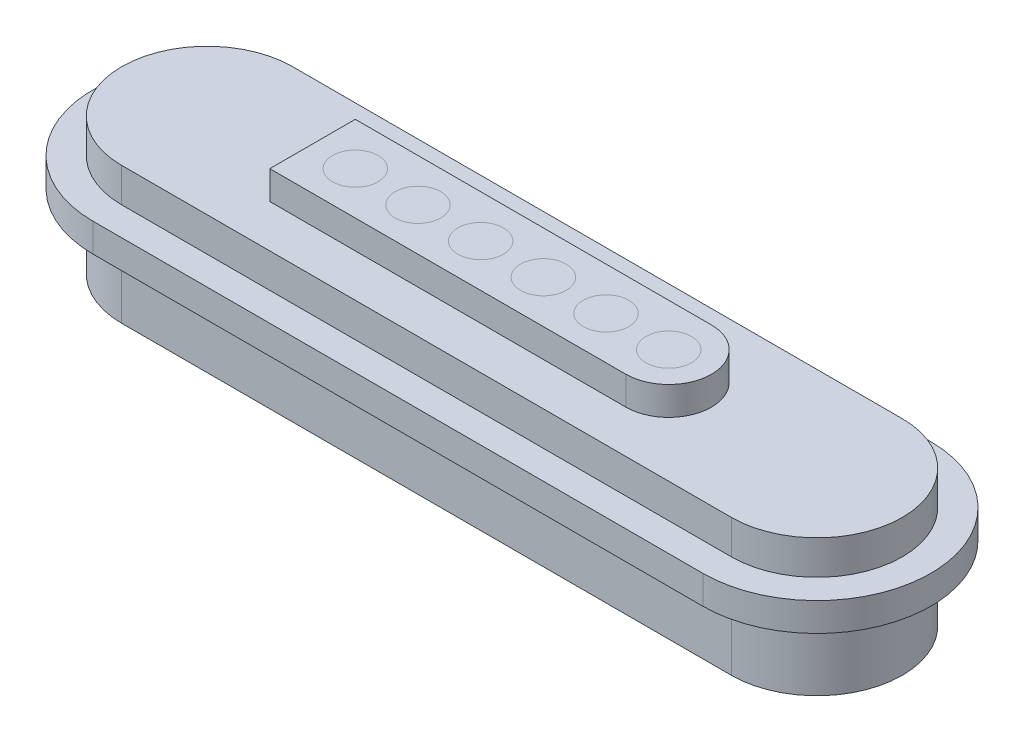
from build123d import *

# Parameters (mm, degrees)
BOSS_EXTRUDE1_DEPTH        = 4.8
SKETCH1_3_R                = 0.8
BOSS_EXTRUDE2_DEPTH        = 5.8
BOSS_EXTRUDE3_START        = 2.6
BOSS_EXTRUDE3_DEPTH        = 1
BOSS_EXTRUDE4_DEPTH        = 5.8
BOSS_EXTRUDE4_DEPTH_BACK   = 1.5
SKETCH1_5_R                = 0.8
BOSS_EXTRUDE4_2_DEPTH      = 5.8
BOSS_EXTRUDE4_2_DEPTH_BACK = 1.5
BOSS_EXTRUDE4_3_DEPTH      = 5.8
BOSS_EXTRUDE4_3_DEPTH_BACK = 1.5
BOSS_EXTRUDE4_4_DEPTH      = 5.8
BOSS_EXTRUDE4_4_DEPTH_BACK = 1.5
BOSS_EXTRUDE4_5_DEPTH      = 5.8
BOSS_EXTRUDE4_5_DEPTH_BACK = 1.5
BOSS_EXTRUDE4_6_DEPTH      = 5.8
BOSS_EXTRUDE4_6_DEPTH_BACK = 1.5


with BuildPart() as part:
    # Sketch1 → Boss-Extrude1 (new body)
    with BuildSketch(Plane(origin=(0, 0, 0), x_dir=(1, 0, 0), z_dir=(0, 1, 0))):
        with BuildLine():
            Line((21.4, 3), (0, 3))
            ThreePointArc((0, 3), (-3, 0), (0, -3))
            Line((0, -3), (21.4, -3))
            ThreePointArc((21.4, -3), (24.4, 0), (21.4, 3))
        make_face()
        with BuildLine():
            ThreePointArc((16.213938129, 1.499935241), (17.699983809, -0.006969321), (16.199999637, -1.5))
            Line((16.199999637, -1.5), (3.699983809, -1.499996975))
            Line((3.699983809, -1.499996975), (3.699983809, 1.499935241))
            Line((3.699983809, 1.499935241), (16.213938129, 1.499935241))
        make_face(mode=Mode.SUBTRACT)
    extrude(amount=BOSS_EXTRUDE1_DEPTH)

    # Sketch1<3> → Boss-Extrude2 (add)
    with BuildSketch(Plane(origin=(0, 0, 0), x_dir=(1, 0, 0), z_dir=(0, 1, 0))):
        with BuildLine():
            Line((3.699983809, -1.499996975), (16.199999637, -1.5))
            ThreePointArc((16.199999637, -1.5), (17.699983809, -0.006969321), (16.213938129, 1.499935241))
            Line((16.213938129, 1.499935241), (3.699983809, 1.499935241))
            Line((3.699983809, 1.499935241), (3.699983809, -1.499996975))
        make_face()
        with Locations((5.2, 0)):
            Circle(SKETCH1_3_R, mode=Mode.SUBTRACT)
        with Locations((7.4, 0)):
            Circle(SKETCH1_3_R, mode=Mode.SUBTRACT)
        with Locations((9.6, 0)):
            Circle(SKETCH1_3_R, mode=Mode.SUBTRACT)
        with Locations((11.8, 0)):
            Circle(SKETCH1_3_R, mode=Mode.SUBTRACT)
        with Locations((14, 0)):
            Circle(SKETCH1_3_R, mode=Mode.SUBTRACT)
        with Locations((16.2, 0)):
            Circle(SKETCH1_3_R, mode=Mode.SUBTRACT)
    extrude(amount=BOSS_EXTRUDE2_DEPTH)

    # Sketch1<4> → Boss-Extrude3 (add)
    with BuildSketch(Plane(origin=(0, 0, 0), x_dir=(1, 0, 0), z_dir=(0, 1, 0)).offset(BOSS_EXTRUDE3_START)):
        with BuildLine():
            Line((21.4, 4), (0, 4))
            ThreePointArc((0, 4), (-4, 0), (0, -4))
            Line((0, -4), (21.4, -4))
            ThreePointArc((21.4, -4), (25.4, 0), (21.4, 4))
        make_face()
        with BuildLine():
            ThreePointArc((0, -3), (-3, 0), (0, 3))
            Line((0, 3), (21.4, 3))
            ThreePointArc((21.4, 3), (24.4, 0), (21.4, -3))
            Line((21.4, -3), (0, -3))
        make_face(mode=Mode.SUBTRACT)
    extrude(amount=BOSS_EXTRUDE3_DEPTH)


with BuildPart() as body_2:
    # Sketch1<5> → Boss-Extrude4 (new, two sides: drawn at the far end of the back side and taken through both)
    with BuildSketch(Plane(origin=(0, 0, 0), x_dir=(1, 0, 0), z_dir=(0, 1, 0)).offset(-BOSS_EXTRUDE4_DEPTH_BACK)):
        with Locations((11.8, 0)):
            Circle(SKETCH1_5_R)
    extrude(amount=BOSS_EXTRUDE4_DEPTH + BOSS_EXTRUDE4_DEPTH_BACK)


with BuildPart() as body_3:
    # Sketch1<5> → Boss-Extrude4 2 (new, two sides: drawn at the far end of the back side and taken through both)
    with BuildSketch(Plane(origin=(0, 0, 0), x_dir=(1, 0, 0), z_dir=(0, 1, 0)).offset(-BOSS_EXTRUDE4_2_DEPTH_BACK)):
        with Locations((14, 0)):
            Circle(SKETCH1_5_R)
    extrude(amount=BOSS_EXTRUDE4_2_DEPTH + BOSS_EXTRUDE4_2_DEPTH_BACK)


with BuildPart() as body_4:
    # Sketch1<5> → Boss-Extrude4 3 (new, two sides: drawn at the far end of the back side and taken through both)
    with BuildSketch(Plane(origin=(0, 0, 0), x_dir=(1, 0, 0), z_dir=(0, 1, 0)).offset(-BOSS_EXTRUDE4_3_DEPTH_BACK)):
        with Locations((16.2, 0)):
            Circle(SKETCH1_5_R)
    extrude(amount=BOSS_EXTRUDE4_3_DEPTH + BOSS_EXTRUDE4_3_DEPTH_BACK)


with BuildPart() as body_5:
    # Sketch1<5> → Boss-Extrude4 4 (new, two sides: drawn at the far end of the back side and taken through both)
    with BuildSketch(Plane(origin=(0, 0, 0), x_dir=(1, 0, 0), z_dir=(0, 1, 0)).offset(-BOSS_EXTRUDE4_4_DEPTH_BACK)):
        with Locations((5.2, 0)):
            Circle(SKETCH1_5_R)
    extrude(amount=BOSS_EXTRUDE4_4_DEPTH + BOSS_EXTRUDE4_4_DEPTH_BACK)


with BuildPart() as body_6:
    # Sketch1<5> → Boss-Extrude4 5 (new, two sides: drawn at the far end of the back side and taken through both)
    with BuildSketch(Plane(origin=(0, 0, 0), x_dir=(1, 0, 0), z_dir=(0, 1, 0)).offset(-BOSS_EXTRUDE4_5_DEPTH_BACK)):
        with Locations((7.4, 0)):
            Circle(SKETCH1_5_R)
    extrude(amount=BOSS_EXTRUDE4_5_DEPTH + BOSS_EXTRUDE4_5_DEPTH_BACK)


with BuildPart() as body_7:
    # Sketch1<5> → Boss-Extrude4 6 (new, two sides: drawn at the far end of the back side and taken through both)
    with BuildSketch(Plane(origin=(0, 0, 0), x_dir=(1, 0, 0), z_dir=(0, 1, 0)).offset(-BOSS_EXTRUDE4_6_DEPTH_BACK)):
        with Locations((9.6, 0)):
            Circle(SKETCH1_5_R)
    extrude(amount=BOSS_EXTRUDE4_6_DEPTH + BOSS_EXTRUDE4_6_DEPTH_BACK)


solid = Compound([part.part, body_2.part, body_3.part, body_4.part, body_5.part, body_6.part, body_7.part])
